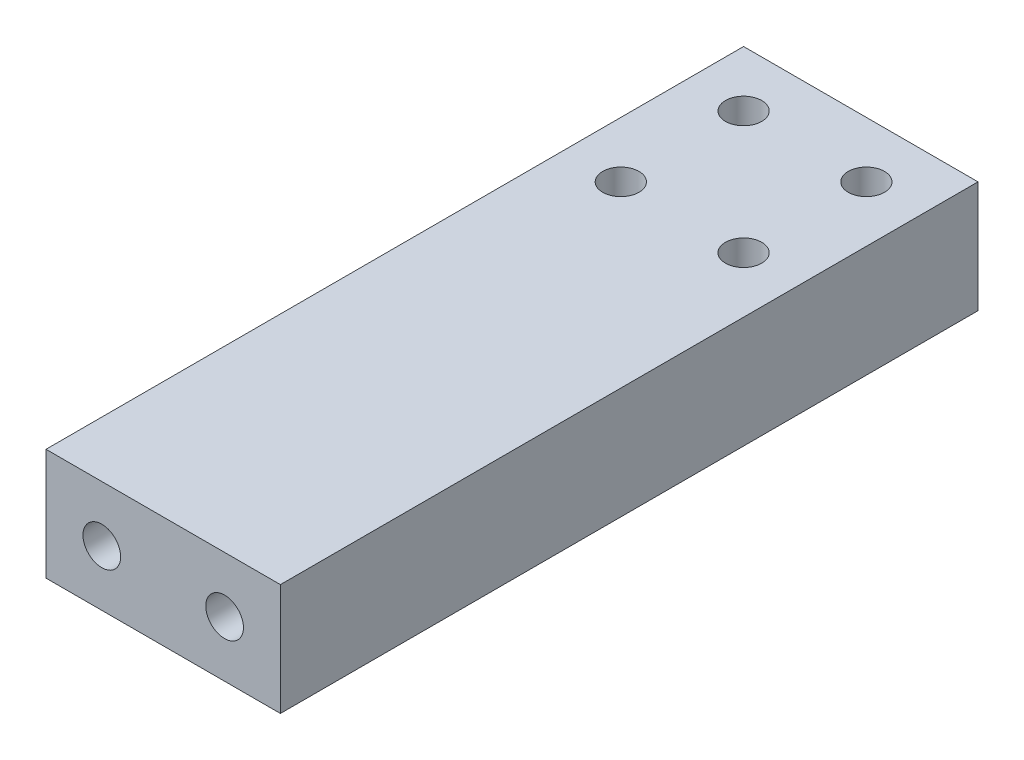
from build123d import *

# Parameters (mm, degrees)
ESQUISSE1_W             = 42
ESQUISSE1_H             = 20
BASE_EXTRUSION_DEPTH    = 125
ENL_V_MAT_EXTRU_1_REACH = 135.375
ESQUISSE2_R             = 3.25
ESQUISSE3_R             = 3.375
ENL_V_MAT_EXTRU_2_DEPTH = 25


with BuildPart() as part:
    # Esquisse1 → Base-Extrusion (new body)
    with BuildSketch(Plane.XY):
        with Locations((21, 10)):
            Rectangle(ESQUISSE1_W, ESQUISSE1_H)
    extrude(amount=BASE_EXTRUSION_DEPTH)

    # Esquisse2 → Enlèv. mat.-Extru.1 (cut, up to next)
    with BuildSketch(Plane(origin=(0, 20, 0), x_dir=(-1, 0, 0), z_dir=(0, 1, 0)), mode=Mode.PRIVATE) as enl_v_mat_extru_1_sk1:
        with Locations(Location((-10, 10, 0), (0, 0, 90))):
            Circle(ESQUISSE2_R)
    enl_v_mat_extru_1_tool1 = extrude(enl_v_mat_extru_1_sk1.sketch, amount=-ENL_V_MAT_EXTRU_1_REACH, mode=Mode.PRIVATE) & part.part
    # Esquisse2 → Enlèv. mat.-Extru.1 (cut, up to next)
    with BuildSketch(Plane(origin=(0, 20, 0), x_dir=(-1, 0, 0), z_dir=(0, 1, 0)), mode=Mode.PRIVATE) as enl_v_mat_extru_1_sk2:
        with Locations(Location((-32, 10, 0), (0, 0, 90))):
            Circle(ESQUISSE2_R)
    enl_v_mat_extru_1_tool2 = extrude(enl_v_mat_extru_1_sk2.sketch, amount=-ENL_V_MAT_EXTRU_1_REACH, mode=Mode.PRIVATE) & part.part
    # Esquisse2 → Enlèv. mat.-Extru.1 (cut, up to next)
    with BuildSketch(Plane(origin=(0, 20, 0), x_dir=(-1, 0, 0), z_dir=(0, 1, 0)), mode=Mode.PRIVATE) as enl_v_mat_extru_1_sk3:
        with Locations(Location((-10, 32, 0), (0, 0, 90))):
            Circle(ESQUISSE2_R)
    enl_v_mat_extru_1_tool3 = extrude(enl_v_mat_extru_1_sk3.sketch, amount=-ENL_V_MAT_EXTRU_1_REACH, mode=Mode.PRIVATE) & part.part
    # Esquisse2 → Enlèv. mat.-Extru.1 (cut, up to next)
    with BuildSketch(Plane(origin=(0, 20, 0), x_dir=(-1, 0, 0), z_dir=(0, 1, 0)), mode=Mode.PRIVATE) as enl_v_mat_extru_1_sk4:
        with Locations(Location((-32, 32, 0), (0, 0, 90))):
            Circle(ESQUISSE2_R)
    enl_v_mat_extru_1_tool4 = extrude(enl_v_mat_extru_1_sk4.sketch, amount=-ENL_V_MAT_EXTRU_1_REACH, mode=Mode.PRIVATE) & part.part
    add(enl_v_mat_extru_1_tool1.solids().sort_by_distance((10, 20, 10))[0], mode=Mode.SUBTRACT)
    add(enl_v_mat_extru_1_tool2.solids().sort_by_distance((32, 20, 10))[0], mode=Mode.SUBTRACT)
    add(enl_v_mat_extru_1_tool3.solids().sort_by_distance((10, 20, 32))[0], mode=Mode.SUBTRACT)
    add(enl_v_mat_extru_1_tool4.solids().sort_by_distance((32, 20, 32))[0], mode=Mode.SUBTRACT)

    # Esquisse3 → Enlèv. mat.-Extru.2 (cut)
    with BuildSketch(Plane.XY.offset(125)):
        with Locations((10, 10)):
            Circle(ESQUISSE3_R)
        with Locations((32, 10)):
            Circle(ESQUISSE3_R)
    extrude(amount=-ENL_V_MAT_EXTRU_2_DEPTH, mode=Mode.SUBTRACT)


solid = part.part
